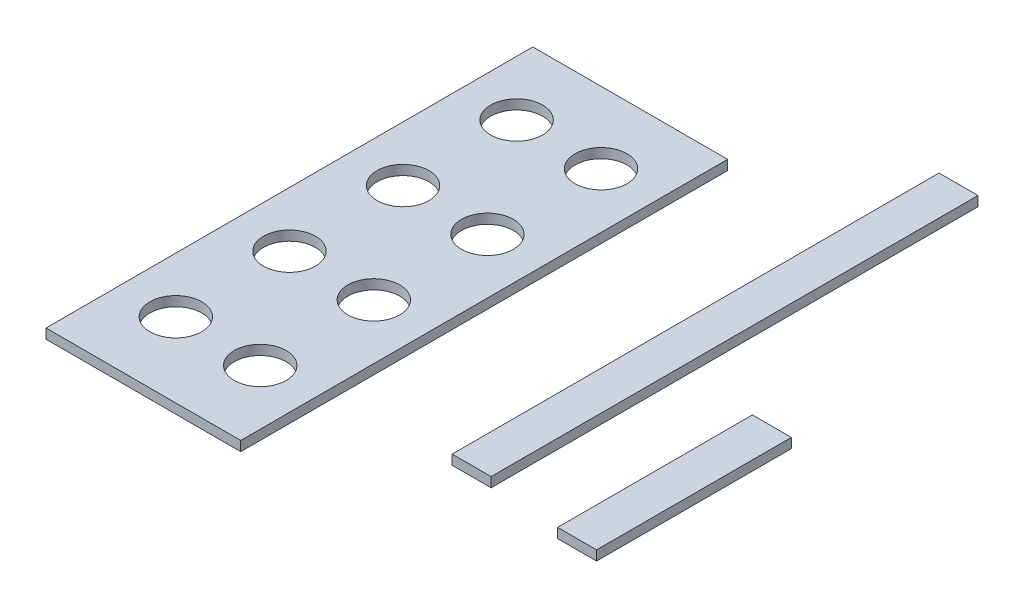
from build123d import *

# Parameters (mm, degrees)
SKETCH1_W           = 60
SKETCH1_H           = 150
BOSS_EXTRUDE2_DEPTH = 3
SKETCH2_W           = 12
SKETCH2_H           = 150
BOSS_EXTRUDE4_DEPTH = 3
SKETCH3_W           = 12
SKETCH3_H           = 60
BOSS_EXTRUDE5_DEPTH = 3
SKETCH4_R           = 8
CUT_EXTRUDE1_DEPTH  = 3


with BuildPart() as part:
    # Sketch1 → Boss-Extrude2 (new body)
    with BuildSketch(Plane(origin=(0, 0, 0), x_dir=(1, 0, 0), z_dir=(0, 1, 0))):
        with Locations((-8.377535101, 62.644305772)):
            Rectangle(SKETCH1_W, SKETCH1_H)
    extrude(amount=BOSS_EXTRUDE2_DEPTH)

    # Sketch4 → Cut-Extrude1 (cut)
    with BuildSketch(Plane(origin=(0, 3, 0), x_dir=(1, 0, 0), z_dir=(0, 1, 0))):
        with Locations(Location((4.622464899, 10.644305772, 0), (0, 0, 270))):
            Circle(SKETCH4_R)
        with Locations(Location((-21.377535101, 10.644305772, 0), (0, 0, 270))):
            Circle(SKETCH4_R)
        with Locations(Location((4.622464899, 45.644305772, 0), (0, 0, 270))):
            Circle(SKETCH4_R)
        with Locations(Location((-21.377535101, 45.644305772, 0), (0, 0, 270))):
            Circle(SKETCH4_R)
        with Locations(Location((4.622464899, 80.644305772, 0), (0, 0, 270))):
            Circle(SKETCH4_R)
        with Locations(Location((-21.377535101, 80.644305772, 0), (0, 0, 270))):
            Circle(SKETCH4_R)
        with Locations(Location((4.622464899, 115.644305772, 0), (0, 0, 270))):
            Circle(SKETCH4_R)
        with Locations(Location((-21.377535101, 115.644305772, 0), (0, 0, 270))):
            Circle(SKETCH4_R)
    extrude(amount=-CUT_EXTRUDE1_DEPTH, mode=Mode.SUBTRACT)


with BuildPart() as body_2:
    # Sketch2 → Boss-Extrude4 (new body)
    with BuildSketch(Plane(origin=(0, 0, 0), x_dir=(1, 0, 0), z_dir=(0, 1, 0))):
        with Locations((63.836257857, 91.57184727)):
            Rectangle(SKETCH2_W, SKETCH2_H)
    extrude(amount=BOSS_EXTRUDE4_DEPTH)


with BuildPart() as body_3:
    # Sketch3 → Boss-Extrude5 (new body)
    with BuildSketch(Plane(origin=(0, 0, 0), x_dir=(1, 0, 0), z_dir=(0, 1, 0))):
        with Locations((99.629560174, 43.26681982)):
            Rectangle(SKETCH3_W, SKETCH3_H)
    extrude(amount=BOSS_EXTRUDE5_DEPTH)


solid = Compound([part.part, body_2.part, body_3.part])
